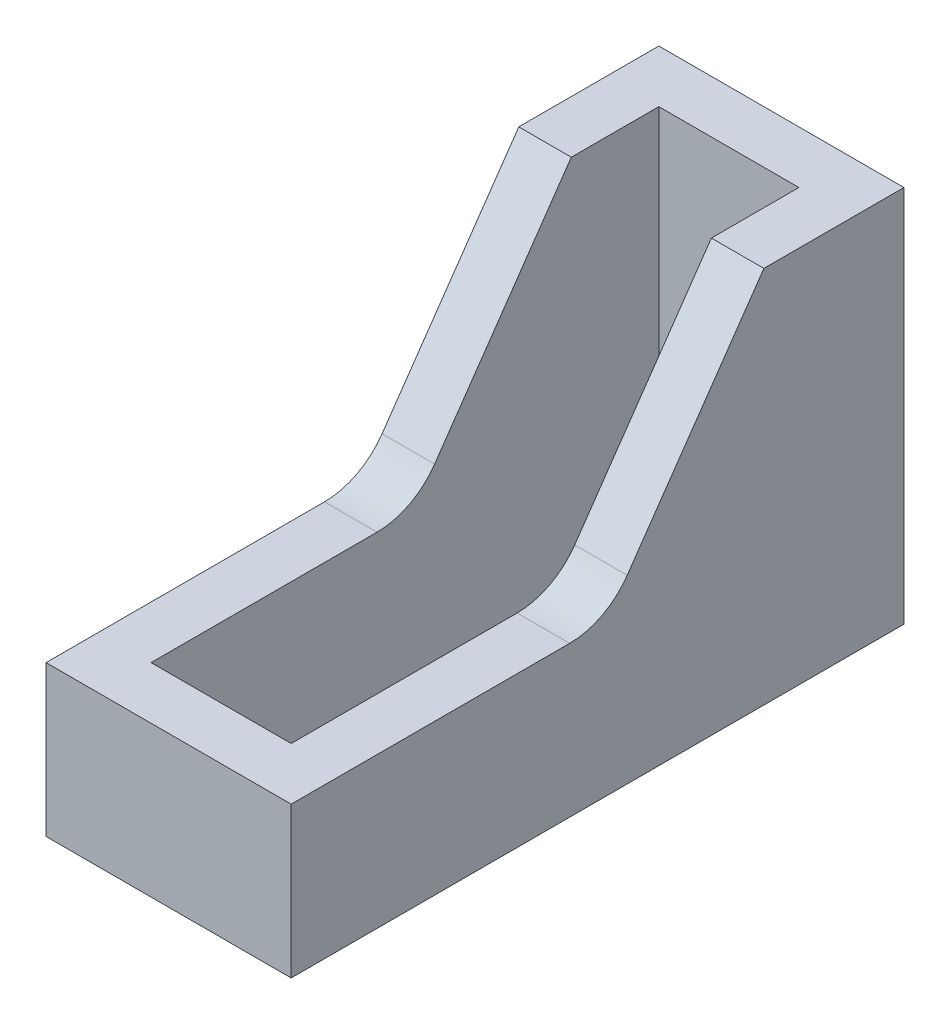
from build123d import *

# Parameters (mm, degrees)
CROQUIS1_W                 = 7
CROQUIS1_H                 = 10.8
SALIENTE_EXTRUIR1_DEPTH    = 17.5
CROQUIS4_W                 = 3.5
CROQUIS4_H                 = 14.5
CORTAR_EXTRUIR1_DEPTH      = 17.5
CORTAR_EXTRUIR2_DEPTH      = 22.723029255
CORTAR_EXTRUIR2_DEPTH_BACK = 22.723029255
CROQUIS6_W                 = 4
CROQUIS6_H                 = 14.5
CORTAR_EXTRUIR3_DEPTH      = 17.5


with BuildPart() as part:
    # Croquis1 → Saliente-Extruir1 (new body)
    with BuildSketch(Plane.XY):
        with Locations((3.5, 5.4)):
            Rectangle(CROQUIS1_W, CROQUIS1_H)
    extrude(amount=SALIENTE_EXTRUIR1_DEPTH)

    # Croquis4 → Cortar-Extruir1 (cut)
    with BuildSketch(Plane(origin=(0, 10.8, 0), x_dir=(1, 0, 0), z_dir=(0, 1, 0))):
        with Locations((3.25, -8.75)):
            Rectangle(CROQUIS4_W, CROQUIS4_H)
    extrude(amount=-CORTAR_EXTRUIR1_DEPTH, mode=Mode.SUBTRACT)

    # Croquis5 → Cortar-Extruir2 (cut, two sides: drawn at the far end of the back side and taken through both)
    with BuildSketch(Plane(origin=(7, 0, 0), x_dir=(0, 0, -1), z_dir=(1, 0, 0)).offset(-CORTAR_EXTRUIR2_DEPTH_BACK)):
        with BuildLine():
            Line((-7.903521509, 5.161580042), (-4, 10.8))
            Line((-4, 10.8), (-17.5, 10.8))
            Line((-17.5, 10.8), (-17.5, 4.3))
            Line((-17.5, 4.3), (-9.547905892, 4.3))
            ThreePointArc((-9.547905892, 4.3), (-8.619692532, 4.528441376), (-7.903521509, 5.161580042))
        make_face()
    extrude(amount=CORTAR_EXTRUIR2_DEPTH + CORTAR_EXTRUIR2_DEPTH_BACK, mode=Mode.SUBTRACT)

    # Croquis6 → Cortar-Extruir3 (cut)
    with BuildSketch(Plane(origin=(0, 10.8, 0), x_dir=(1, 0, 0), z_dir=(0, 1, 0))):
        with Locations((3.5, -8.75)):
            Rectangle(CROQUIS6_W, CROQUIS6_H)
    extrude(amount=-CORTAR_EXTRUIR3_DEPTH, mode=Mode.SUBTRACT)


solid = part.part
